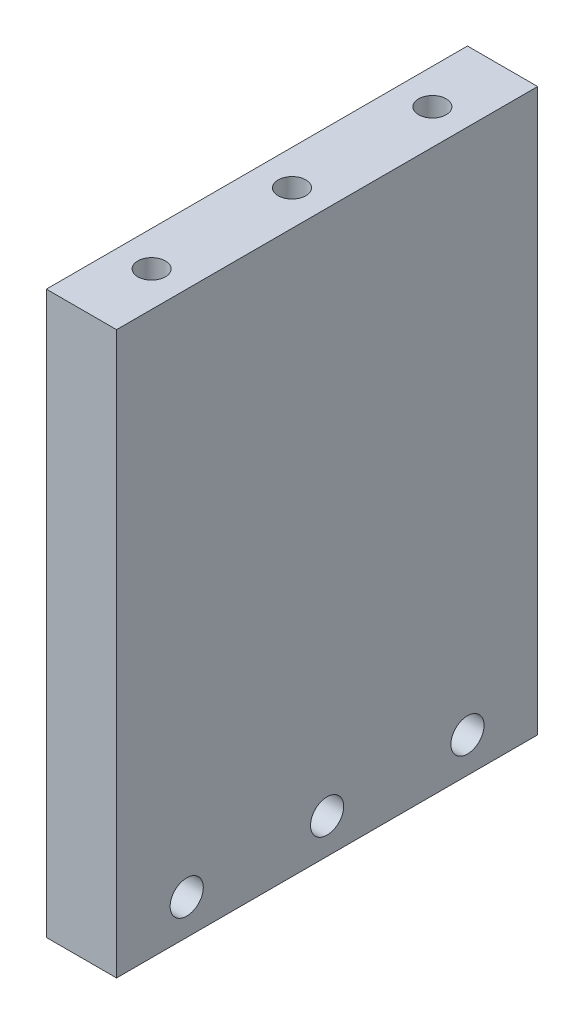
from build123d import *

# Parameters (mm, degrees)
SKETCH1_W           = 6.35
SKETCH1_H           = 50.8
BOSS_EXTRUDE1_DEPTH = 38.1
CUT_EXTRUDE1_DEPTH  = 6.35
CUT_EXTRUDE2_DEPTH  = 6.35


with BuildPart() as part:
    # Sketch1 → Boss-Extrude1 (new body)
    with BuildSketch(Plane.XY):
        with Locations((3.175, 25.4)):
            Rectangle(SKETCH1_W, SKETCH1_H)
    extrude(amount=BOSS_EXTRUDE1_DEPTH)

    # Sketch2 → Cut-Extrude1 (cut)
    with BuildSketch(Plane(origin=(6.35, 0, 0), x_dir=(0, 0, -1), z_dir=(1, 0, 0))):
        with BuildLine():
            ThreePointArc((-7.85, 3.175), (-6.35, 1.675), (-4.85, 3.175))
            Line((-4.85, 3.175), (-6.35, 3.175))
            Line((-6.35, 3.175), (-7.85, 3.175))
        make_face()
        with BuildLine():
            Line((-6.35, 3.175), (-4.85, 3.175))
            ThreePointArc((-4.85, 3.175), (-6.35, 4.675), (-7.85, 3.175))
            Line((-7.85, 3.175), (-6.35, 3.175))
        make_face()
        with BuildLine():
            ThreePointArc((-17.55, 3.175), (-19.05, 4.675), (-20.55, 3.175))
            Line((-20.55, 3.175), (-17.55, 3.175))
        make_face()
        with BuildLine():
            Line((-17.55, 3.175), (-20.55, 3.175))
            ThreePointArc((-20.55, 3.175), (-19.05, 1.675), (-17.55, 3.175))
        make_face()
        with BuildLine():
            ThreePointArc((-30.25, 3.175), (-31.75, 4.675), (-33.25, 3.175))
            Line((-33.25, 3.175), (-31.75, 3.175))
            Line((-31.75, 3.175), (-30.25, 3.175))
        make_face()
        with BuildLine():
            Line((-31.75, 3.175), (-33.25, 3.175))
            ThreePointArc((-33.25, 3.175), (-31.75, 1.675), (-30.25, 3.175))
            Line((-30.25, 3.175), (-31.75, 3.175))
        make_face()
    extrude(amount=-CUT_EXTRUDE1_DEPTH, mode=Mode.SUBTRACT)

    # Sketch3 → Cut-Extrude2 (cut)
    with BuildSketch(Plane(origin=(0, 50.8, 0), x_dir=(1, 0, 0), z_dir=(0, 1, 0))):
        with BuildLine():
            ThreePointArc((4.425, -6.35), (4.058883476, -5.466116524), (3.175, -5.1))
            Line((3.175, -5.1), (3.175, -6.35))
            Line((3.175, -6.35), (3.175, -7.6))
            ThreePointArc((3.175, -7.6), (4.058883476, -7.233883476), (4.425, -6.35))
        make_face()
        with BuildLine():
            Line((3.175, -6.35), (3.175, -5.1))
            ThreePointArc((3.175, -5.1), (1.925, -6.35), (3.175, -7.6))
            Line((3.175, -7.6), (3.175, -6.35))
        make_face()
        with BuildLine():
            ThreePointArc((4.425, -19.05), (4.058883476, -18.166116524), (3.175, -17.8))
            Line((3.175, -17.8), (3.175, -20.3))
            ThreePointArc((3.175, -20.3), (4.058883476, -19.933883476), (4.425, -19.05))
        make_face()
        with BuildLine():
            Line((3.175, -20.3), (3.175, -17.8))
            ThreePointArc((3.175, -17.8), (1.925, -19.05), (3.175, -20.3))
        make_face()
        with BuildLine():
            ThreePointArc((3.175, -30.5), (1.925, -31.75), (3.175, -33))
            Line((3.175, -33), (3.175, -31.75))
            Line((3.175, -31.75), (3.175, -30.5))
        make_face()
        with BuildLine():
            Line((3.175, -31.75), (3.175, -33))
            ThreePointArc((3.175, -33), (4.058883476, -32.633883476), (4.425, -31.75))
            ThreePointArc((4.425, -31.75), (4.058883476, -30.866116524), (3.175, -30.5))
            Line((3.175, -30.5), (3.175, -31.75))
        make_face()
    extrude(amount=-CUT_EXTRUDE2_DEPTH, mode=Mode.SUBTRACT)


solid = part.part
